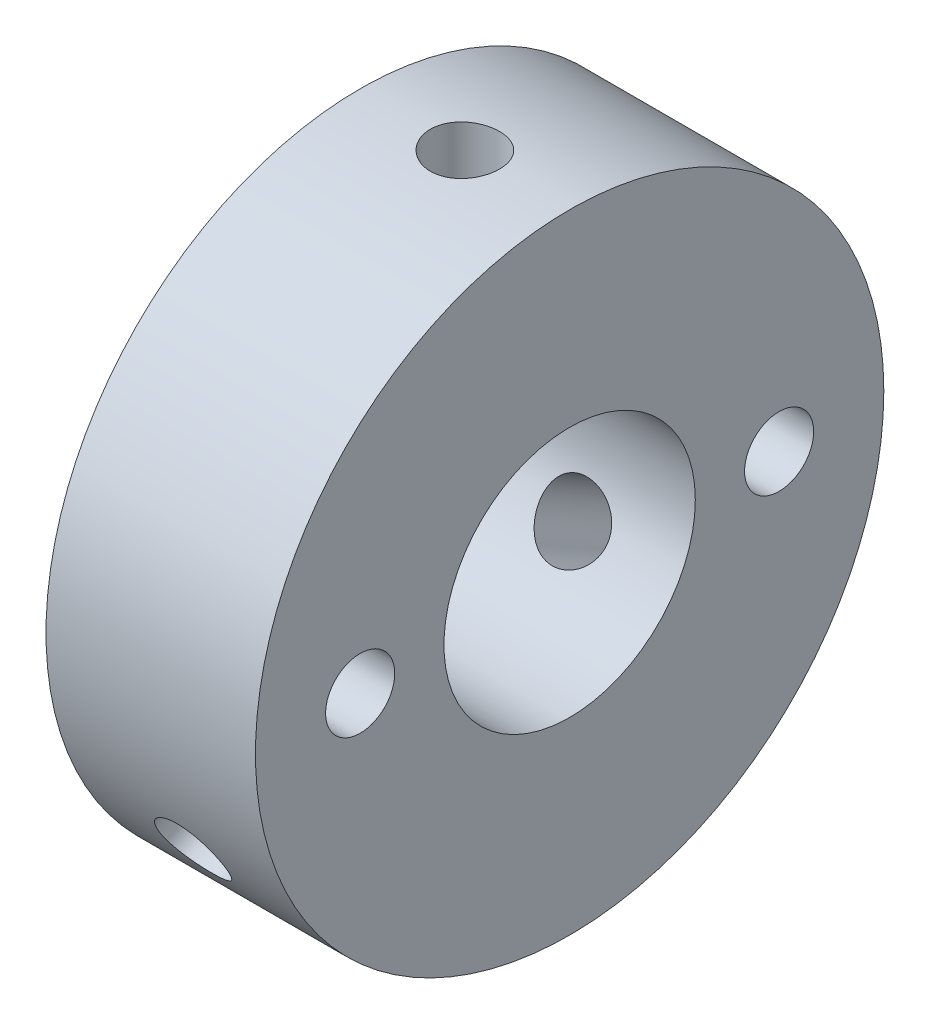
from build123d import *

# Parameters (mm, degrees)
SKETCH_1_R               = 15
SKETCH_1_R_2             = 6
SKETCH_1_R_3             = 1.65
EXTRUDE_1_DEPTH          = 10
SKETCH_2_R               = 1.65
CUT_EXTRUDE_1_DEPTH      = 24.452078799
PATTERN_CIRCULAR_1_COUNT = 3


with BuildPart() as part:
    # ｽｹｯﾁ1 → ﾎﾞｽ - 押し出し1 (new body)
    with BuildSketch(Plane(origin=(0, 0, 0), x_dir=(0, 0, -1), z_dir=(1, 0, 0))):
        Circle(SKETCH_1_R)
        Circle(SKETCH_1_R_2, mode=Mode.SUBTRACT)
        with Locations((-10, 0)):
            Circle(SKETCH_1_R_3, mode=Mode.SUBTRACT)
        with Locations(Location((10, 0, 0), (0, 0, 180))):
            Circle(SKETCH_1_R_3, mode=Mode.SUBTRACT)
    extrude(amount=EXTRUDE_1_DEPTH)

    # ｽｹｯﾁ2 → ｶｯﾄ - 押し出し1 (cut, through all)
    with BuildSketch(Plane(origin=(0, 0, 0), x_dir=(1, 0, 0), z_dir=(0, 1, 0))):
        with Locations(Location((5, 0, 0), (0, 0, 90))):
            Circle(SKETCH_2_R)
    cut_extrude_1 = extrude(amount=CUT_EXTRUDE_1_DEPTH, mode=Mode.SUBTRACT)

    # 円形ﾊﾟﾀｰﾝ1: ｶｯﾄ - 押し出し1 ×3 about axis
    pattern_circular_1_axis = Axis((10, 0, 0), (1, 0, 0))
    for i in range(1, PATTERN_CIRCULAR_1_COUNT):
        add(cut_extrude_1.rotate(pattern_circular_1_axis, i * 360 / PATTERN_CIRCULAR_1_COUNT), mode=Mode.SUBTRACT)


solid = part.part
